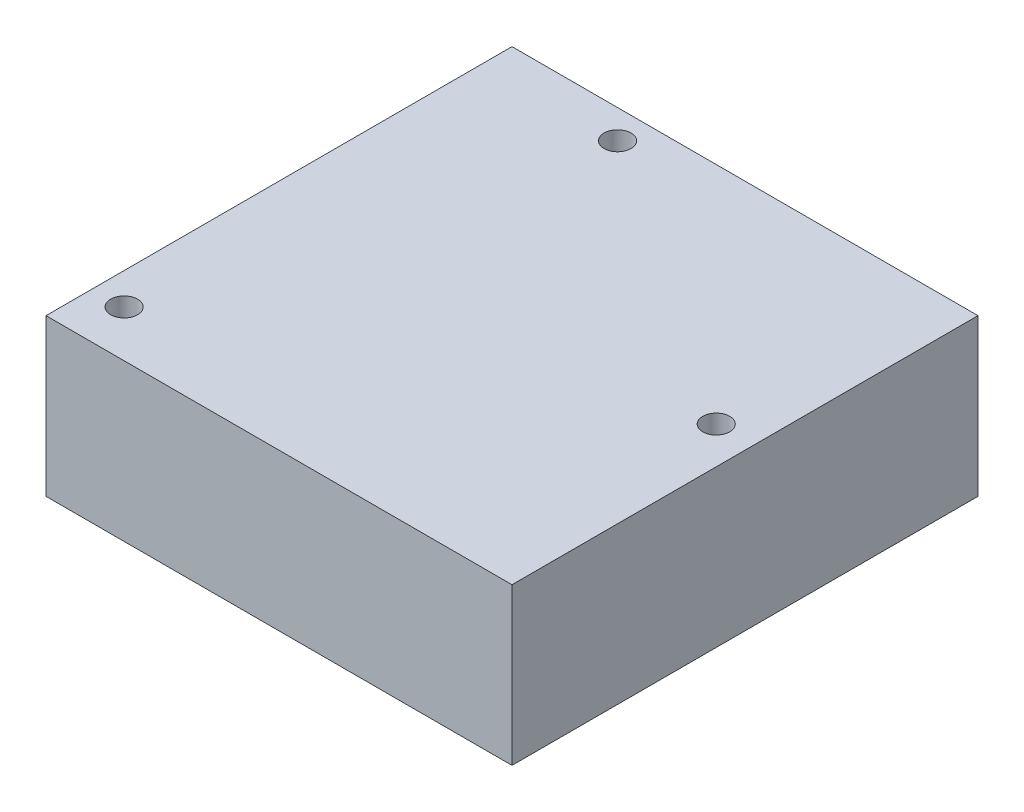
from build123d import *

# Parameters (mm, degrees)
SKETCH1_W             = 43.18
SKETCH1_H             = 43.18
BOSS_EXTRUDE1_DEPTH   = 15
M3X0_5_TAPPED_HOLE1_D = 2.5
CHAMFER1_SIZE         = 0.5


with BuildPart() as part:
    # Sketch1 → Boss-Extrude1 (new body)
    with BuildSketch(Plane(origin=(0, 0, 0), x_dir=(1, 0, 0), z_dir=(0, 1, 0))):
        Rectangle(SKETCH1_W, SKETCH1_H)
    extrude(amount=BOSS_EXTRUDE1_DEPTH)

    # M3x0.5 Tapped Hole1 (through all)
    with Locations(Plane(origin=(0, 15, 0), x_dir=(1, 0, 0), z_dir=(0, 1, 0))):
        with Locations((-18.669, -17.272), (-9.144, 18.923), (18.161, 0.762)):
            Hole(M3X0_5_TAPPED_HOLE1_D / 2)

    # Chamfer1
    chamfer1_edges = [part.edges().sort_by_distance(p)[0] for p in [
        (21.59, 0, 0),
        (0, 0, 21.59),
        (-21.59, 0, 0),
        (0, 0, -21.59),
    ]]
    chamfer(chamfer1_edges, length=CHAMFER1_SIZE)


solid = part.part
